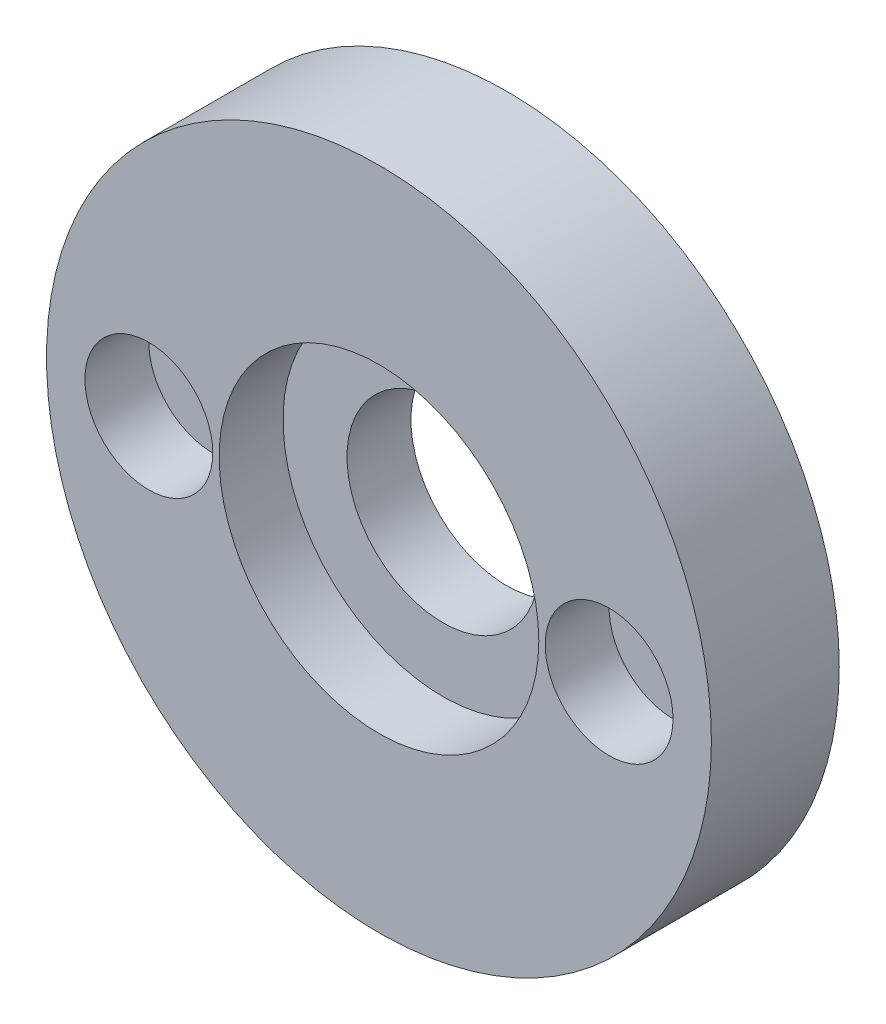
from build123d import *

# Parameters (mm, degrees)
SKETCH_4_R          = 26
SKETCH_4_R_2        = 5
SKETCH_4_R_3        = 7.5
EXTRUDE_2_DEPTH     = 10
SKETCH_4_4_R        = 5
SKETCH_4_4_R_2      = 2
EXTRUDE_3_DEPTH     = 5
SKETCH_5_R          = 12.5
CUT_EXTRUDE_3_DEPTH = 5


with BuildPart() as part:
    # 草图4 → 凸台-拉伸2 (new body)
    with BuildSketch(Plane.XY):
        Circle(SKETCH_4_R)
        with Locations((-18, 0)):
            Circle(SKETCH_4_R_2, mode=Mode.SUBTRACT)
        Circle(SKETCH_4_R_3, mode=Mode.SUBTRACT)
        with Locations((18, 0)):
            Circle(SKETCH_4_R_2, mode=Mode.SUBTRACT)
    extrude(amount=EXTRUDE_2_DEPTH)

    # 草图4<4> → 凸台-拉伸3 (add)
    # profile 1 of 2: a face of its own
    with BuildSketch(Plane.XY):
        with Locations((-18, 0)):
            Circle(SKETCH_4_4_R)
        with Locations((-18, 0)):
            Circle(SKETCH_4_4_R_2, mode=Mode.SUBTRACT)
    # profile 2 of 2: a face of its own
    with BuildSketch(Plane.XY):
        with Locations((18, 0)):
            Circle(SKETCH_4_4_R)
        with Locations((18, 0)):
            Circle(SKETCH_4_4_R_2, mode=Mode.SUBTRACT)
    extrude(amount=EXTRUDE_3_DEPTH)

    # 草图5 → 切除-拉伸3 (cut)
    with BuildSketch(Plane.XY.offset(10)):
        Circle(SKETCH_5_R)
    extrude(amount=-CUT_EXTRUDE_3_DEPTH, mode=Mode.SUBTRACT)


solid = part.part
